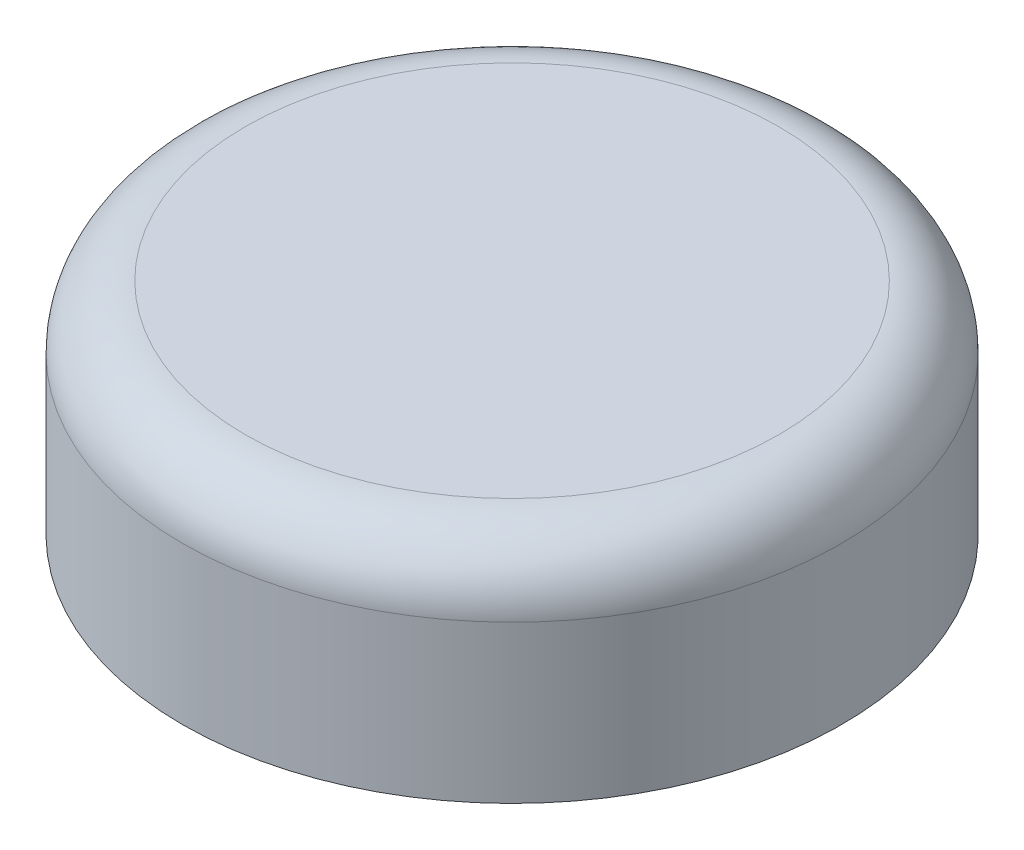
from build123d import *

# Parameters (mm, degrees)
SKETCH1_R           = 10.5
BOSS_EXTRUDE2_DEPTH = 7
FILLET1_R           = 2


with BuildPart() as part:
    # Sketch1 → Boss-Extrude2 (new body)
    with BuildSketch(Plane(origin=(0, 0, 0), x_dir=(1, 0, 0), z_dir=(0, 1, 0))):
        with Locations(Location((0, 0, 0), (0, 0, 270))):
            Circle(SKETCH1_R)
    extrude(amount=BOSS_EXTRUDE2_DEPTH)

    # Fillet1
    fillet1_edges = [part.edges().sort_by_distance(p)[0] for p in [
        (0, 7, -10.5),
    ]]
    fillet(fillet1_edges, radius=FILLET1_R)


solid = part.part
